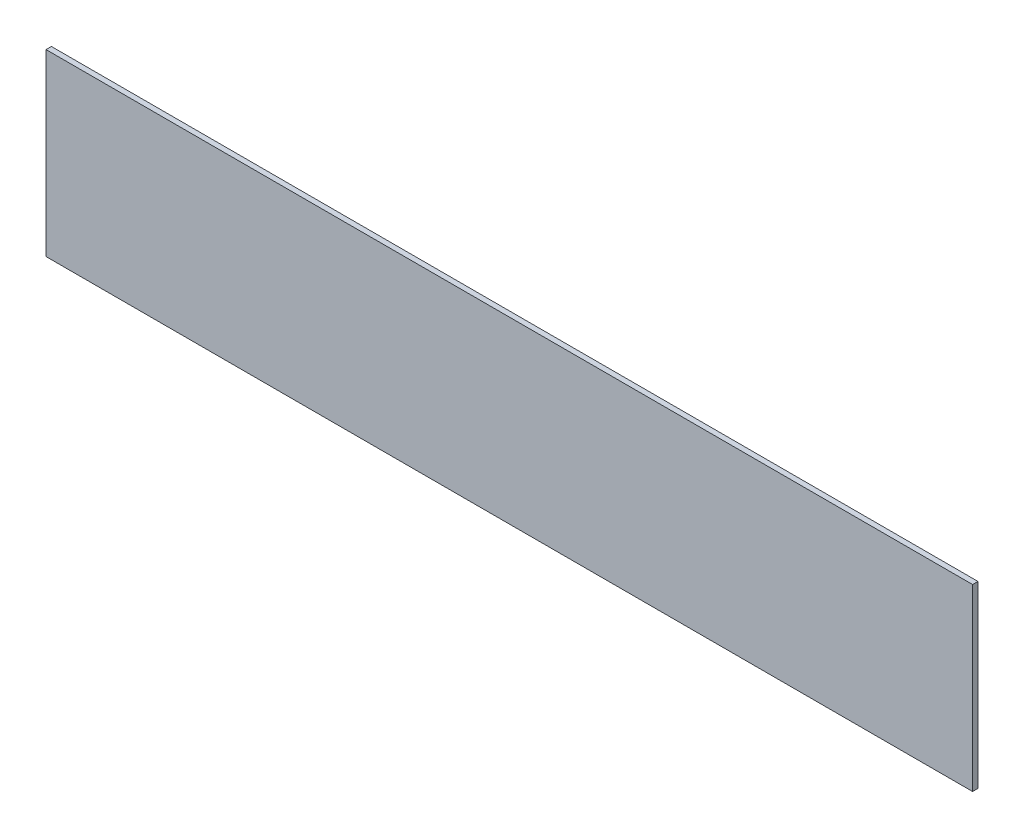
from build123d import *

# Parameters (mm, degrees)
SKETCH1_W           = 41.35
SKETCH1_H           = 8
BOSS_EXTRUDE1_DEPTH = 0.24


with BuildPart() as part:
    # Sketch1 → Boss-Extrude1 (new body)
    with BuildSketch(Plane.XY):
        with Locations((20.675, 4)):
            Rectangle(SKETCH1_W, SKETCH1_H)
    extrude(amount=BOSS_EXTRUDE1_DEPTH)


solid = part.part
